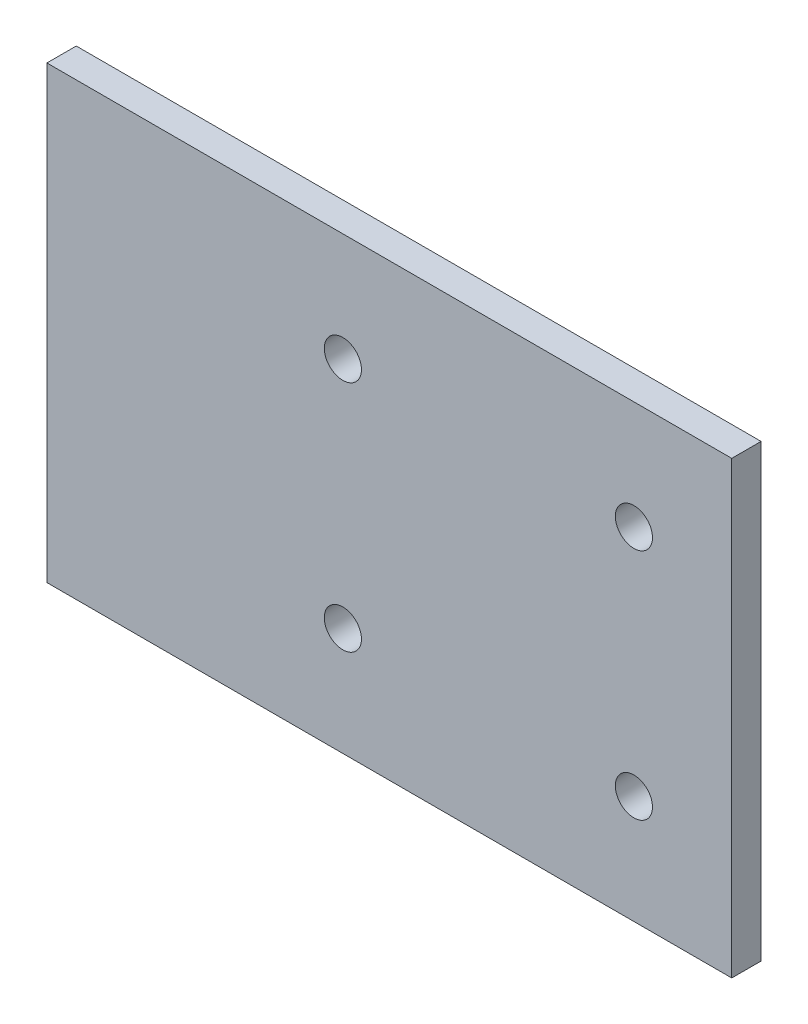
from build123d import *

# Parameters (mm, degrees)
SKETCH1_W             = 70
SKETCH1_H             = 46
BOSS_EXTRUDE1_DEPTH   = 3
F_6_CLEARANCE_HOLE1_D = 3.7973


with BuildPart() as part:
    # Sketch1 → Boss-Extrude1 (new body)
    with BuildSketch(Plane.XY):
        with Locations((-1.014344262, 1.590163934)):
            Rectangle(SKETCH1_W, SKETCH1_H)
    extrude(amount=BOSS_EXTRUDE1_DEPTH)

    # #6 Clearance Hole1 (through all)
    with Locations(Plane.XY.offset(3)):
        with Locations((23.985655738, 13.515163934), (23.985655738, -10.334836066), (-5.764344262, -10.334836066), (-5.764344262, 13.515163934)):
            Hole(F_6_CLEARANCE_HOLE1_D / 2)


solid = part.part
